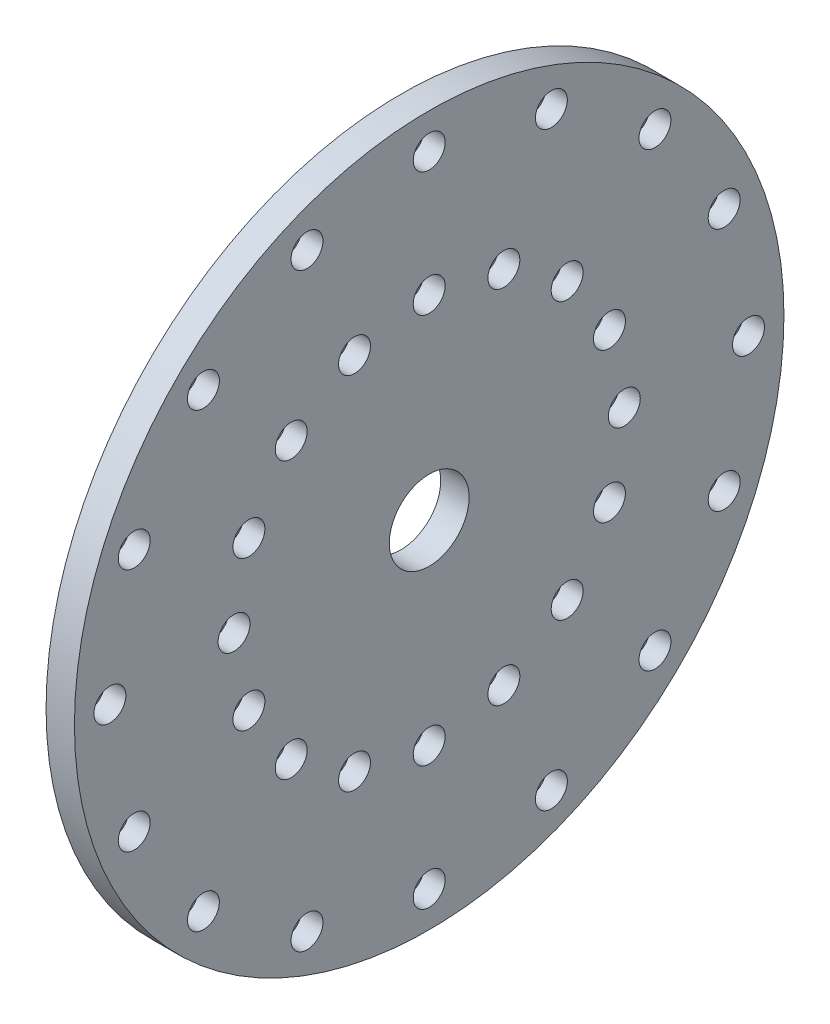
from build123d import *

# Parameters (mm, degrees)
SKETCH1_R               = 200
BOSS_EXTRUDE1_DEPTH     = 16
CUT_EXTRUDE1_DEPTH      = 284.294899354
CUT_EXTRUDE1_DEPTH_BACK = 284.294899354
SKETCH2_R               = 22.5
SKETCH3_R               = 6
CUT_EXTRUDE2_DEPTH      = 284.294899354
CIRPATTERN1_COUNT       = 16
SKETCH4_R               = 6
CUT_EXTRUDE3_DEPTH      = 284.294899354
CIRPATTERN2_COUNT       = 16
SKETCH5_R               = 9
CUT_EXTRUDE4_DEPTH      = 12
CIRPATTERN3_COUNT       = 16
SKETCH6_R               = 9
CUT_EXTRUDE5_DEPTH      = 12
CIRPATTERN4_COUNT       = 16


with BuildPart() as part:
    # Sketch1 → Boss-Extrude1 (new body)
    with BuildSketch(Plane(origin=(0, 0, 0), x_dir=(0, 0, -1), z_dir=(1, 0, 0))):
        Circle(SKETCH1_R)
    extrude(amount=BOSS_EXTRUDE1_DEPTH)

    # Sketch2 → Cut-Extrude1 (cut, two sides: drawn at the far end of the back side and taken through both)
    with BuildSketch(Plane(origin=(16, 0, 0), x_dir=(0, 0, -1), z_dir=(1, 0, 0)).offset(-CUT_EXTRUDE1_DEPTH_BACK)):
        Circle(SKETCH2_R)
    extrude(amount=CUT_EXTRUDE1_DEPTH + CUT_EXTRUDE1_DEPTH_BACK, mode=Mode.SUBTRACT)

    # Sketch3 → Cut-Extrude2 (cut, symmetric)
    with BuildSketch(Plane(origin=(16, 0, 0), x_dir=(0, 0, -1), z_dir=(1, 0, 0))):
        with Locations((110, 0)):
            Circle(SKETCH3_R)
    cut_extrude2 = extrude(amount=CUT_EXTRUDE2_DEPTH, both=True, mode=Mode.SUBTRACT)

    # CirPattern1: Cut-Extrude2 ×16 about axis
    cirpattern1_axis = Axis((0, 0, 0), (1, 0, 0))
    for i in range(1, CIRPATTERN1_COUNT):
        add(cut_extrude2.rotate(cirpattern1_axis, i * 360 / CIRPATTERN1_COUNT), mode=Mode.SUBTRACT)

    # Sketch4 → Cut-Extrude3 (cut, symmetric)
    with BuildSketch(Plane(origin=(16, 0, 0), x_dir=(0, 0, -1), z_dir=(1, 0, 0))):
        with Locations((180, 0)):
            Circle(SKETCH4_R)
    cut_extrude3 = extrude(amount=CUT_EXTRUDE3_DEPTH, both=True, mode=Mode.SUBTRACT)

    # CirPattern2: Cut-Extrude3 ×16 about axis
    cirpattern2_axis = Axis((0, 0, 0), (1, 0, 0))
    for i in range(1, CIRPATTERN2_COUNT):
        add(cut_extrude3.rotate(cirpattern2_axis, i * 360 / CIRPATTERN2_COUNT), mode=Mode.SUBTRACT)

    # Sketch5 → Cut-Extrude4 (cut)
    with BuildSketch(Plane(origin=(16, 0, 0), x_dir=(0, 0, -1), z_dir=(1, 0, 0))):
        with Locations((166.298315852, 68.883017826)):
            Circle(SKETCH5_R)
    cut_extrude4 = extrude(amount=-CUT_EXTRUDE4_DEPTH, mode=Mode.SUBTRACT)

    # CirPattern3: Cut-Extrude4 ×16 about axis
    cirpattern3_axis = Axis((0, 0, 0), (1, 0, 0))
    for i in range(1, CIRPATTERN3_COUNT):
        add(cut_extrude4.rotate(cirpattern3_axis, i * 360 / CIRPATTERN3_COUNT), mode=Mode.SUBTRACT)

    # Sketch6 → Cut-Extrude5 (cut)
    with BuildSketch(Plane(origin=(16, 0, 0), x_dir=(0, 0, -1), z_dir=(1, 0, 0))):
        with Locations((101.626748576, 42.09517756)):
            Circle(SKETCH6_R)
    cut_extrude5 = extrude(amount=-CUT_EXTRUDE5_DEPTH, mode=Mode.SUBTRACT)

    # CirPattern4: Cut-Extrude5 ×16 about axis
    cirpattern4_axis = Axis((0, 0, 0), (1, 0, 0))
    for i in range(1, CIRPATTERN4_COUNT):
        add(cut_extrude5.rotate(cirpattern4_axis, i * 360 / CIRPATTERN4_COUNT), mode=Mode.SUBTRACT)


solid = part.part
